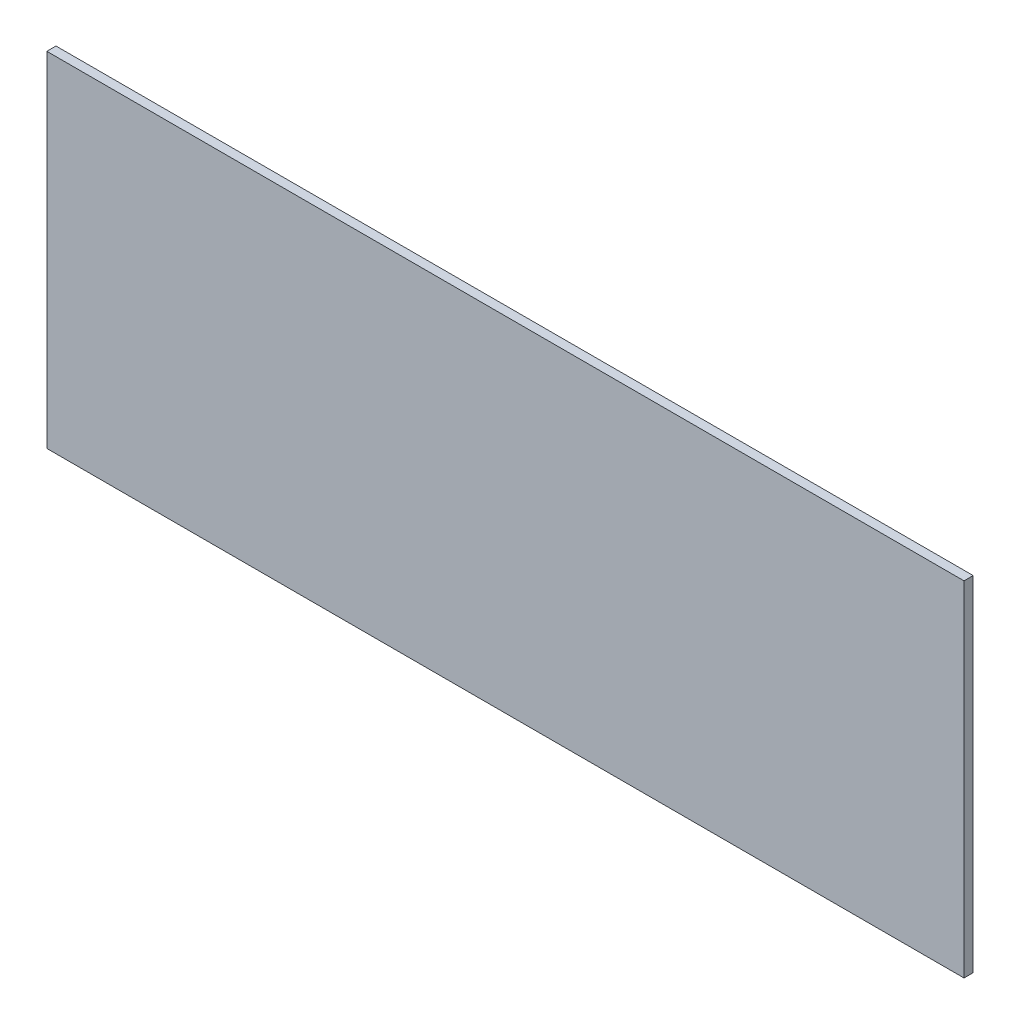
from build123d import *

# Parameters (mm, degrees)
SKETCH1_W           = 400
SKETCH1_H           = 150
BOSS_EXTRUDE1_DEPTH = 4


with BuildPart() as part:
    # Sketch1 → Boss-Extrude1 (new body)
    with BuildSketch(Plane.XY):
        with Locations((200, -75)):
            Rectangle(SKETCH1_W, SKETCH1_H)
    extrude(amount=BOSS_EXTRUDE1_DEPTH)


solid = part.part
